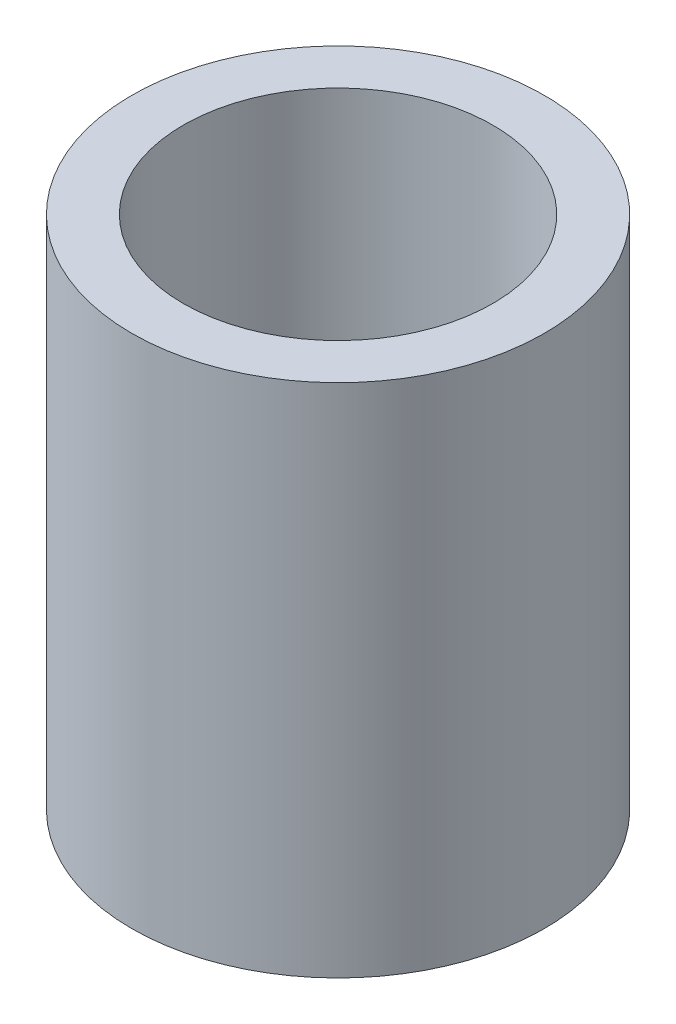
from build123d import *

# Parameters (mm, degrees)
SKETCH1_R           = 6.35
BOSS_EXTRUDE1_DEPTH = 15.875
SKETCH2_R           = 4.7625
CUT_EXTRUDE1_DEPTH  = 19.238986403


with BuildPart() as part:
    # Sketch1 → Boss-Extrude1 (new body)
    with BuildSketch(Plane(origin=(0, 0, 0), x_dir=(1, 0, 0), z_dir=(0, 1, 0))):
        with Locations(Location((0, 0, 0), (0, 0, 270))):
            Circle(SKETCH1_R)
    extrude(amount=BOSS_EXTRUDE1_DEPTH)

    # Sketch2 → Cut-Extrude1 (cut, through all)
    with BuildSketch(Plane(origin=(0, 15.875, 0), x_dir=(1, 0, 0), z_dir=(0, 1, 0))):
        with Locations(Location((0, 0, 0), (0, 0, 270))):
            Circle(SKETCH2_R)
    extrude(amount=-CUT_EXTRUDE1_DEPTH, mode=Mode.SUBTRACT)


solid = part.part
